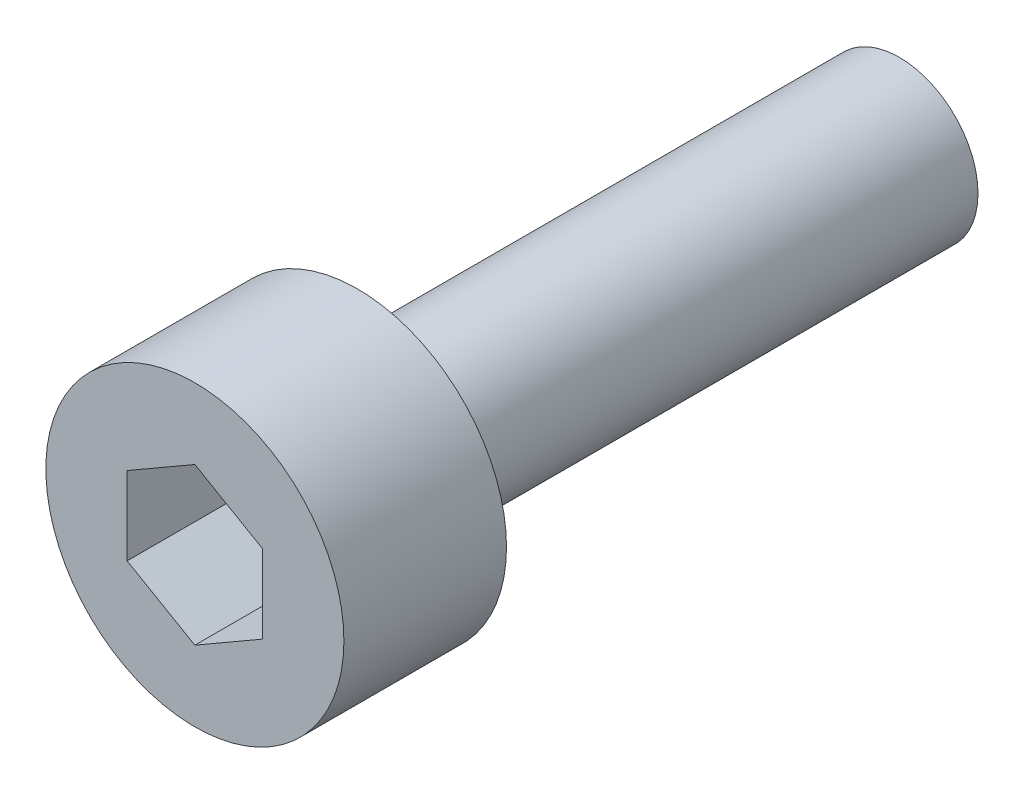
from build123d import *

# Parameters (mm, degrees)
SKETCH_1_R                     = 1.45
SHANK_THREADS_SIMPLIFIED_DEPTH = 10
SKETCH_2_R                     = 2.75
SOCKET_HEAD_DEPTH              = 3
HEX_SOCKET_DEPTH               = 1.95


with BuildPart() as part:
    # 草图1 → Shank_threads_simplified (new body)
    with BuildSketch(Plane.XY):
        Circle(SKETCH_1_R)
    extrude(amount=-SHANK_THREADS_SIMPLIFIED_DEPTH)

    # 草图2 → Socket_head (add)
    with BuildSketch(Plane.XY):
        Circle(SKETCH_2_R)
    extrude(amount=SOCKET_HEAD_DEPTH)

    # 草图3 → Hex_socket (cut)
    with BuildSketch(Plane.XY.offset(3)):
        Polygon((1.25, 0.721687836), (0, 1.443375673), (-1.25, 0.721687836), (-1.25, -0.721687836), (0, -1.443375673), (1.25, -0.721687836), align=None)
    extrude(amount=-HEX_SOCKET_DEPTH, mode=Mode.SUBTRACT)


solid = part.part
